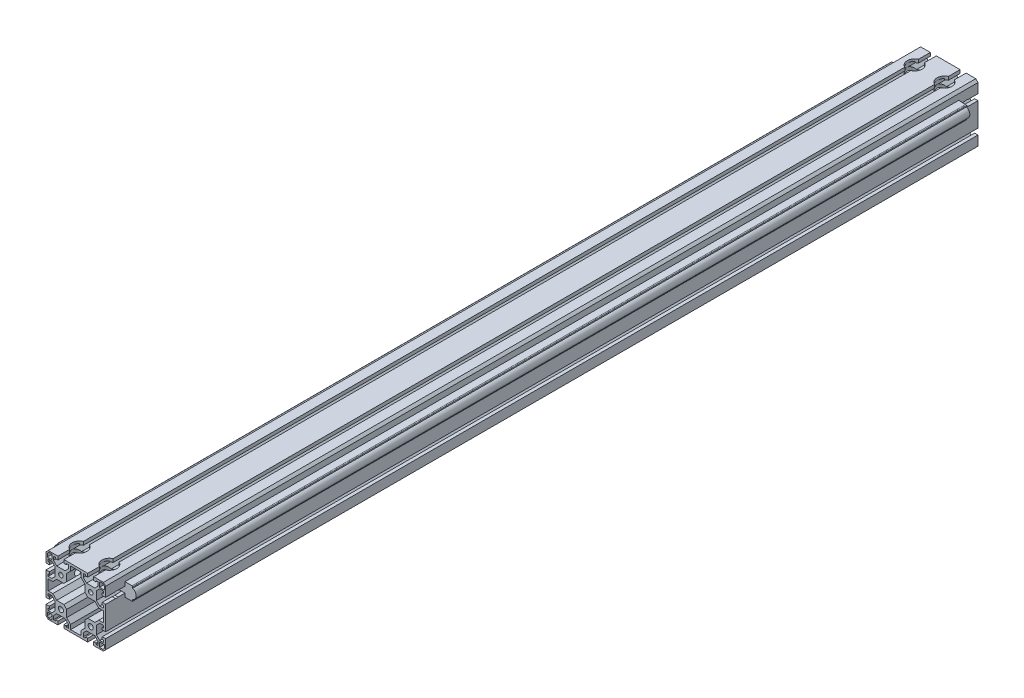
from build123d import *

# Parameters (mm, degrees)
BEAM_LENGTH_DEPTH                = 585.5
BEAM_LENGTH_DEPTH_BACK           = 585.5
SKETCH1_R                        = 3
M8X1_25_TAPPED_HOLE4_D           = 6.8
M8X1_25_TAPPED_HOLE4_DEPTH       = 19.05
M8X1_25_TAPPED_HOLE4_TIP         = 2.042926105
M8X1_25_TAPPED_HOLE5_D           = 6.8
M8X1_25_TAPPED_HOLE5_DEPTH       = 19.05
M8X1_25_TAPPED_HOLE5_TIP         = 2.042926105
F_11_32_0_34375_DIAMETER_HOLE2_D = 8.73125
F_20_0_20_DIAMETER_HOLE1_D       = 20
F_20_0_20_DIAMETER_HOLE1_DEPTH   = 16
BOSS_EXTRUDE1_DEPTH              = 559.5
BOSS_EXTRUDE1_DEPTH_BACK         = 559.5
SKETCH34_R                       = 7


with BuildPart() as part:
    # Sketch1 → BEAM LENGTH (new, two sides: drawn at the far end of the back side and taken through both)
    with BuildSketch(Plane.XY.offset(-BEAM_LENGTH_DEPTH_BACK)):
        Polygon((6, 3), (3, 3), (3, 4.5), (0, 4.5), (0, 0), (32, 0), (32, 4.5), (29, 4.5), (29, 3), (26, 3), (26, 7.875), (30.375, 12.25), (41.625, 12.25), (46, 7.875), (46, 3), (43, 3), (43, 4.5), (40, 4.5), (40, 0), (53, 0), (56, 3), (56, 16), (51.5, 16), (51.5, 13), (53, 13), (53, 10), (48.125, 10), (43.75, 14.375), (43.75, 25.625), (48.125, 30), (53, 30), (53, 27), (51.5, 27), (51.5, 24), (56, 24), (56, 56), (51.5, 56), (51.5, 53), (53, 53), (53, 50), (48.125, 50), (43.75, 54.375), (43.75, 65.625), (48.125, 70), (53, 70), (53, 67), (51.5, 67), (51.5, 64), (56, 64), (56, 77), (53, 80), (40, 80), (40, 75.5), (43, 75.5), (43, 77), (46, 77), (46, 72.125), (41.625, 67.75), (30.375, 67.75), (26, 72.125), (26, 77), (29, 77), (29, 75.5), (32, 75.5), (32, 80), (0, 80), (0, 75.5), (3, 75.5), (3, 77), (6, 77), (6, 72.125), (1.625, 67.75), (-9.625, 67.75), (-14, 72.125), (-14, 77), (-11, 77), (-11, 75.5), (-8, 75.5), (-8, 80), (-21, 80), (-24, 77), (-24, 64), (-19.5, 64), (-19.5, 67), (-21, 67), (-21, 70), (-16.125, 70), (-11.75, 65.625), (-11.75, 54.375), (-16.125, 50), (-21, 50), (-21, 53), (-19.5, 53), (-19.5, 56), (-24, 56), (-24, 24), (-19.5, 24), (-19.5, 27), (-21, 27), (-21, 30), (-16.125, 30), (-11.75, 25.625), (-11.75, 14.375), (-16.125, 10), (-21, 10), (-21, 13), (-19.5, 13), (-19.5, 16), (-24, 16), (-24, 3), (-21, 0), (-8, 0), (-8, 4.5), (-11, 4.5), (-11, 3), (-14, 3), (-14, 7.875), (-9.625, 12.25), (1.625, 12.25), (6, 7.875), align=None)
        with Locations((36, 20)):
            Circle(SKETCH1_R, mode=Mode.SUBTRACT)
        with Locations((36, 60)):
            Circle(SKETCH1_R, mode=Mode.SUBTRACT)
        with Locations((-4, 20)):
            Circle(SKETCH1_R, mode=Mode.SUBTRACT)
        with Locations((-4, 60)):
            Circle(SKETCH1_R, mode=Mode.SUBTRACT)
        Polygon((47.78, 1.78), (47.78, 8.22), (54.22, 8.22), (54.22, 3.737300141), (52.262699859, 1.78), align=None, mode=Mode.SUBTRACT)
        Polygon((-15.78, 8.22), (-15.78, 1.78), (-20.262699859, 1.78), (-22.22, 3.737300141), (-22.22, 8.22), align=None, mode=Mode.SUBTRACT)
        Polygon((47.78, 71.78), (47.78, 78.22), (52.262699859, 78.22), (54.22, 76.262699859), (54.22, 71.78), align=None, mode=Mode.SUBTRACT)
        Polygon((-15.78, 78.22), (-15.78, 71.78), (-22.22, 71.78), (-22.22, 76.262699859), (-20.262699859, 78.22), align=None, mode=Mode.SUBTRACT)
        Polygon((41.632359313, 27.75), (32.034271247, 27.75), (28.25, 23.965728753), (28.25, 14.367640687), (23, 9.117640687), (23, 3), (9, 3), (9, 9.117640687), (3.75, 14.367640687), (3.75, 23.965728753), (-0.034271247, 27.75), (-9.632359313, 27.75), (-14.882359313, 33), (-21, 33), (-21, 47), (-14.882359313, 47), (-9.632359313, 52.25), (-0.034271247, 52.25), (3.75, 56.034271247), (3.75, 65.632359313), (9, 70.882359313), (9, 77), (23, 77), (23, 70.882359313), (28.25, 65.632359313), (28.25, 56.034271247), (32.034271247, 52.25), (41.632359313, 52.25), (46.882359313, 47), (53, 47), (53, 33), (46.882359313, 33), align=None, mode=Mode.SUBTRACT)
    extrude(amount=BEAM_LENGTH_DEPTH + BEAM_LENGTH_DEPTH_BACK)

    # M8x1.25 Tapped Hole4
    with Locations(Plane.XY.offset(585.5)):
        with Locations((-4, 20), (36, 20)):
            Hole(M8X1_25_TAPPED_HOLE4_D / 2, depth=M8X1_25_TAPPED_HOLE4_DEPTH)
            with Locations((0, 0, -(M8X1_25_TAPPED_HOLE4_DEPTH + M8X1_25_TAPPED_HOLE4_TIP / 2))):  # 118° drill point
                Cone(0, M8X1_25_TAPPED_HOLE4_D / 2, M8X1_25_TAPPED_HOLE4_TIP, mode=Mode.SUBTRACT)

    # M8x1.25 Tapped Hole5
    with Locations(Plane(origin=(0, 0, -585.5), x_dir=(-1, 0, 0), z_dir=(0, 0, -1))):
        with Locations((4, 20), (-36, 20)):
            Hole(M8X1_25_TAPPED_HOLE5_D / 2, depth=M8X1_25_TAPPED_HOLE5_DEPTH)
            with Locations((0, 0, -(M8X1_25_TAPPED_HOLE5_DEPTH + M8X1_25_TAPPED_HOLE5_TIP / 2))):  # 118° drill point
                Cone(0, M8X1_25_TAPPED_HOLE5_D / 2, M8X1_25_TAPPED_HOLE5_TIP, mode=Mode.SUBTRACT)

    # 11/32 (0.34375) Diameter Hole2 (through all)
    with Locations(Plane(origin=(56, 0, 0), x_dir=(0, 0, -1), z_dir=(1, 0, 0))):
        with Locations((-570.5, 60), (570.5, 60)):
            Hole(F_11_32_0_34375_DIAMETER_HOLE2_D / 2)

    # Ø20.0 (20) Diameter Hole1
    with Locations(Plane(origin=(0, 80, 0), x_dir=(1, 0, 0), z_dir=(0, 1, 0))):
        with Locations((-4, 560.5), (36, 560.5), (-4, -560.5), (36, -560.5)):
            Hole(F_20_0_20_DIAMETER_HOLE1_D / 2, depth=F_20_0_20_DIAMETER_HOLE1_DEPTH)

    # Sketch34 → Boss-Extrude1 (add, two sides: drawn at the far end of the back side and taken through both)
    with BuildSketch(Plane.XY.offset(-BOSS_EXTRUDE1_DEPTH_BACK)):
        with Locations((-32, 60.25)):
            Circle(SKETCH34_R)
        with BuildLine():
            Line((-34.4, 68.25), (-34.4, 66.825712889))
            ThreePointArc((-34.4, 66.825712889), (-27.98751947, 65.98585216), (-25, 60.25))
            ThreePointArc((-25, 60.25), (-27.98751947, 54.51414784), (-34.4, 53.674287111))
            Line((-34.4, 53.674287111), (-34.4, 52.25))
            ThreePointArc((-34.4, 52.25), (-34.107106781, 51.542893219), (-33.4, 51.25))
            Line((-33.4, 51.25), (-24, 51.25))
            Line((-24, 51.25), (-24, 56))
            Line((-24, 56), (-12.4, 56))
            Line((-12.4, 56), (-12.4, 64))
            Line((-12.4, 64), (-24, 64))
            Line((-24, 64), (-24, 69.25))
            Line((-24, 69.25), (-33.4, 69.25))
            ThreePointArc((-33.4, 69.25), (-34.107106781, 68.957106781), (-34.4, 68.25))
        make_face()
        with BuildLine():
            ThreePointArc((66.4, 53.674287111), (57, 60.25), (66.4, 66.825712889))
            Line((66.4, 66.825712889), (66.4, 68.25))
            ThreePointArc((66.4, 68.25), (66.107106781, 68.957106781), (65.4, 69.25))
            Line((65.4, 69.25), (56, 69.25))
            Line((56, 69.25), (56, 64))
            Line((56, 64), (44.4, 64))
            Line((44.4, 64), (44.4, 56))
            Line((44.4, 56), (56, 56))
            Line((56, 56), (56, 51.25))
            Line((56, 51.25), (65.4, 51.25))
            ThreePointArc((65.4, 51.25), (66.107106781, 51.542893219), (66.4, 52.25))
            Line((66.4, 52.25), (66.4, 53.674287111))
        make_face()
        with Locations((64, 60.25)):
            Circle(SKETCH34_R)
    extrude(amount=BOSS_EXTRUDE1_DEPTH + BOSS_EXTRUDE1_DEPTH_BACK)


solid = part.part
